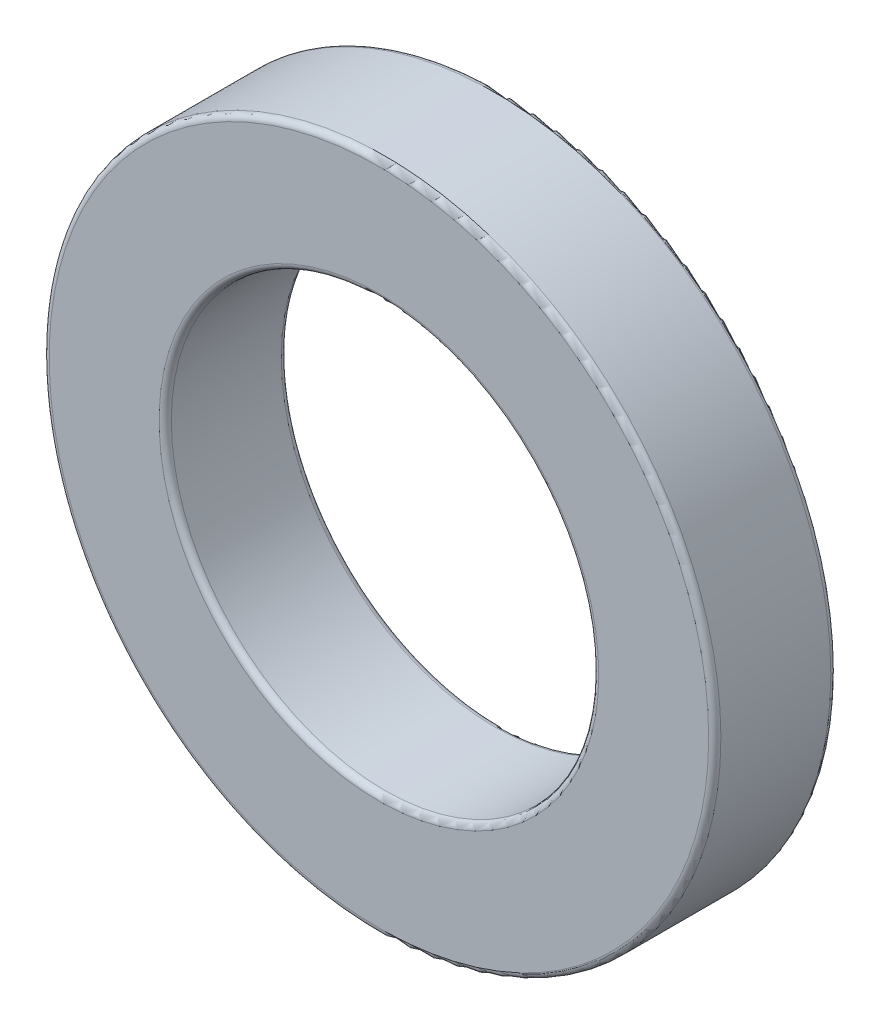
from build123d import *

# Parameters (mm, degrees)
SKETCH_1_R      = 27.5
SKETCH_1_R_2    = 17.5
EXTRUDE_1_DEPTH = 10
FILLET_1_R      = 0.5


with BuildPart() as part:
    # 草图1 → 拉伸1 (new body)
    with BuildSketch(Plane.XY):
        Circle(SKETCH_1_R)
        Circle(SKETCH_1_R_2, mode=Mode.SUBTRACT)
    extrude(amount=EXTRUDE_1_DEPTH)

    # 圆角1
    fillet_1_edges = [part.edges().sort_by_distance(p)[0] for p in [
        (-27.5, 0, 0),
        (-27.5, 0, 10),
        (-17.5, 0, 0),
        (-17.5, 0, 10),
    ]]
    fillet(fillet_1_edges, radius=FILLET_1_R)


solid = part.part
